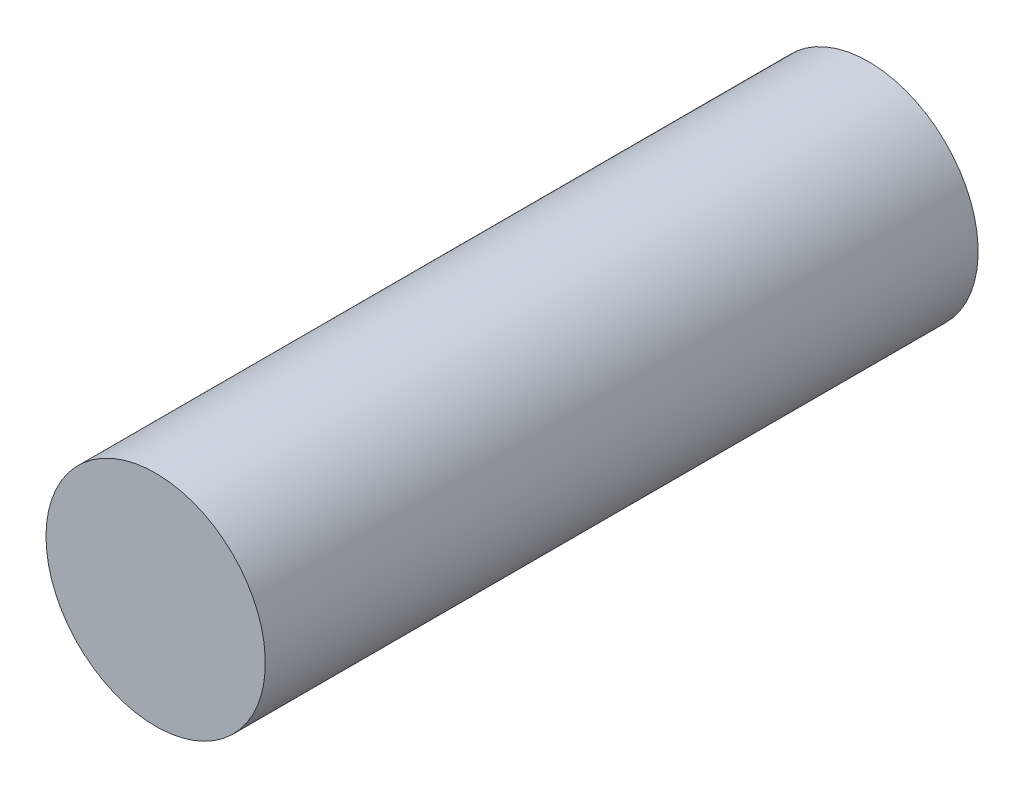
from build123d import *

# Parameters (mm, degrees)
SCHIZZO1_R                   = 2
ESTRUSIONE_ESTRUSIONE1_DEPTH = 13


with BuildPart() as part:
    # Schizzo1 → Estrusione-Estrusione1 (new body)
    with BuildSketch(Plane.XY):
        with Locations(Location((0, 0, 0), (0, 0, 180))):
            Circle(SCHIZZO1_R)
    extrude(amount=ESTRUSIONE_ESTRUSIONE1_DEPTH)


solid = part.part
